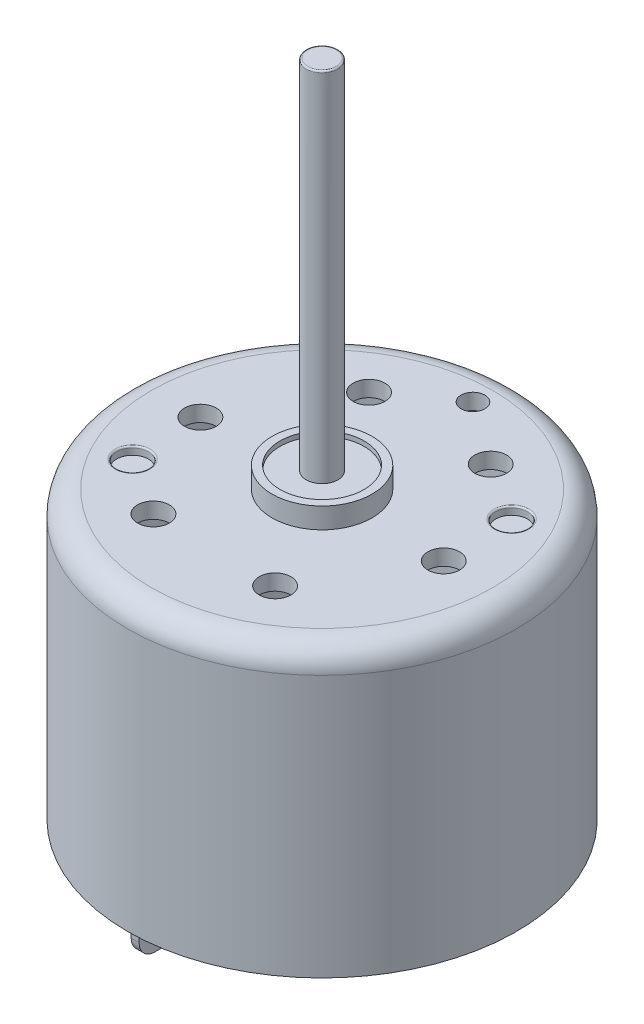
from build123d import *

# Parameters (mm, degrees)
SKETCH1_R               = 12.25
BOSS_EXTRUDE1_DEPTH     = 18
SKETCH2_R               = 3.15
BOSS_EXTRUDE2_DEPTH     = 1.3
SKETCH3_R               = 2.65
CUT_EXTRUDE1_DEPTH      = 0.3
SKETCH4_R               = 1
BOSS_EXTRUDE3_DEPTH     = 22.5
SKETCH5_R               = 11.75
CUT_EXTRUDE2_DEPTH      = 0.5
SKETCH6_R               = 3.25
BOSS_EXTRUDE4_DEPTH     = 2.2
SKETCH7_R               = 1.25
BOSS_EXTRUDE5_DEPTH     = 0.5
CUT_EXTRUDE3_START      = -0.25
SKETCH8_R               = 1.25
CUT_EXTRUDE3_DEPTH      = 0.25
SKETCH9_R               = 0.75
CUT_EXTRUDE4_DEPTH      = 5
SKETCH10_R              = 11.25
CUT_EXTRUDE5_DEPTH      = 16
SKETCH11_W              = 0.5
SKETCH11_H              = 2.5
BOSS_EXTRUDE6_DEPTH     = 3
CUT_EXTRUDE6_DEPTH      = 5
CUT_EXTRUDE6_DEPTH_BACK = 3
SKETCH12_R              = 0.5
FILLET1_R               = 1.5
FILLET2_R               = 1
SKETCH13_R              = 1
SKETCH13_R_2            = 0.75
CUT_EXTRUDE7_DEPTH      = 3
SKETCH14_R              = 1
CUT_EXTRUDE8_DEPTH      = 0.5
FILLET4_R               = 0.1
FILLET5_R               = 0.1


with BuildPart() as part:
    # Sketch1 → Boss-Extrude1 (new body)
    with BuildSketch(Plane(origin=(0, 0, 0), x_dir=(1, 0, 0), z_dir=(0, 1, 0))):
        with Locations(Location((0, 0, 0), (0, 0, 270))):
            Circle(SKETCH1_R)
    extrude(amount=BOSS_EXTRUDE1_DEPTH)

    # Sketch2 → Boss-Extrude2 (add)
    with BuildSketch(Plane(origin=(0, 18, 0), x_dir=(1, 0, 0), z_dir=(0, 1, 0))):
        with Locations(Location((0, 0, 0), (0, 0, 270))):
            Circle(SKETCH2_R)
    extrude(amount=BOSS_EXTRUDE2_DEPTH)

    # Sketch3 → Cut-Extrude1 (cut)
    with BuildSketch(Plane(origin=(0, 19.3, 0), x_dir=(1, 0, 0), z_dir=(0, 1, 0))):
        with Locations(Location((0, 0, 0), (0, 0, 270))):
            Circle(SKETCH3_R)
    extrude(amount=-CUT_EXTRUDE1_DEPTH, mode=Mode.SUBTRACT)

    # Sketch4 → Boss-Extrude3 (add)
    with BuildSketch(Plane(origin=(0, 19, 0), x_dir=(1, 0, 0), z_dir=(0, 1, 0))):
        with Locations(Location((0, 0, 0), (0, 0, 90))):
            Circle(SKETCH4_R)
    extrude(amount=BOSS_EXTRUDE3_DEPTH)

    # Sketch5 → Cut-Extrude2 (cut)
    with BuildSketch(Plane.XZ):
        with Locations(Location((0, 0, 0), (0, 0, 270))):
            Circle(SKETCH5_R)
    extrude(amount=-CUT_EXTRUDE2_DEPTH, mode=Mode.SUBTRACT)

    # Sketch6 → Boss-Extrude4 (add)
    with BuildSketch(Plane.XZ.offset(-0.5)):
        with Locations(Location((0, 0, 0), (0, 0, 270))):
            Circle(SKETCH6_R)
    extrude(amount=BOSS_EXTRUDE4_DEPTH)

    # Sketch7 → Boss-Extrude5 (add)
    with BuildSketch(Plane.XZ.offset(-0.5)):
        with Locations(Location((-5.125831592, -8.586375865, 0), (0, 0, 270))):
            Circle(SKETCH7_R)
        with Locations(Location((5.088620413, -8.586375865, 0), (0, 0, 90))):
            Circle(SKETCH7_R)
        with Locations(Location((5.088620413, 8.586375865, 0), (0, 0, 270))):
            Circle(SKETCH7_R)
        with Locations(Location((-5.125831592, 8.586375865, 0), (0, 0, 90))):
            Circle(SKETCH7_R)
        with BuildLine():
            Line((-2.01860559, -10.748327037), (1.98139441, -10.748327037))
            ThreePointArc((1.98139441, -10.748327037), (2.688501191, -10.455433818), (2.98139441, -9.748327037))
            Line((2.98139441, -9.748327037), (2.98139441, -8.748327037))
            ThreePointArc((2.98139441, -8.748327037), (2.688501191, -8.041220256), (1.98139441, -7.748327037))
            Line((1.98139441, -7.748327037), (-2.01860559, -7.748327037))
            ThreePointArc((-2.01860559, -7.748327037), (-2.725712371, -8.041220256), (-3.01860559, -8.748327037))
            Line((-3.01860559, -8.748327037), (-3.01860559, -9.748327037))
            ThreePointArc((-3.01860559, -9.748327037), (-2.725712371, -10.455433818), (-2.01860559, -10.748327037))
        make_face()
        with BuildLine():
            Line((2.98139441, 9.748327037), (2.98139441, 8.748327037))
            ThreePointArc((2.98139441, 8.748327037), (2.688501191, 8.041220256), (1.98139441, 7.748327037))
            Line((1.98139441, 7.748327037), (-2.01860559, 7.748327037))
            ThreePointArc((-2.01860559, 7.748327037), (-2.725712371, 8.041220256), (-3.01860559, 8.748327037))
            Line((-3.01860559, 8.748327037), (-3.01860559, 9.748327037))
            ThreePointArc((-3.01860559, 9.748327037), (-2.725712371, 10.455433818), (-2.01860559, 10.748327037))
            Line((-2.01860559, 10.748327037), (1.98139441, 10.748327037))
            ThreePointArc((1.98139441, 10.748327037), (2.688501191, 10.455433818), (2.98139441, 9.748327037))
        make_face()
    extrude(amount=BOSS_EXTRUDE5_DEPTH)

    # Sketch8 → Cut-Extrude3 (cut)
    with BuildSketch(Plane.XZ.offset(CUT_EXTRUDE3_START)):
        with Locations(Location((-5.125831592, -8.586375865, 0), (0, 0, 270))):
            Circle(SKETCH8_R)
        with Locations(Location((5.088620413, -8.586375865, 0), (0, 0, 90))):
            Circle(SKETCH8_R)
        with Locations(Location((5.088620413, 8.586375865, 0), (0, 0, 270))):
            Circle(SKETCH8_R)
        with Locations(Location((-5.125831592, 8.586375865, 0), (0, 0, 90))):
            Circle(SKETCH8_R)
    extrude(amount=CUT_EXTRUDE3_DEPTH, mode=Mode.SUBTRACT)

    # Sketch9 → Cut-Extrude4 (cut)
    with BuildSketch(Plane.XZ.offset(-0.5)):
        with Locations(Location((-5.716262807, -3.094242964, 0), (0, 0, 270))):
            Circle(SKETCH9_R)
        with Locations(Location((5.68290106, 3.155096757, 0), (0, 0, 270))):
            Circle(SKETCH9_R)
        with BuildLine():
            Line((-2.62995564, 2.940379794), (-3.030401514, 3.388091892))
            ThreePointArc((-3.030401514, 3.388091892), (-3.080727579, 3.536940742), (-3.007982197, 3.676213147))
            ThreePointArc((-3.007982197, 3.676213147), (-0.752566129, 4.690004714), (1.706803282, 4.432755639))
            ThreePointArc((1.706803282, 4.432755639), (1.819470443, 4.323234847), (1.818240908, 4.166113297))
            Line((1.818240908, 4.166113297), (1.577973384, 3.615591238))
            ThreePointArc((1.577973384, 3.615591238), (1.472408215, 3.51131746), (1.324054135, 3.508472694))
            ThreePointArc((1.324054135, 3.508472694), (-0.594131154, 3.702635301), (-2.355270039, 2.918082083))
            ThreePointArc((-2.355270039, 2.918082083), (-2.497066292, 2.874368833), (-2.62995564, 2.940379794))
        make_face()
        with BuildLine():
            Line((2.62995564, -2.940379794), (3.030401514, -3.388091892))
            ThreePointArc((3.030401514, -3.388091892), (3.080727579, -3.536940742), (3.007982197, -3.676213147))
            ThreePointArc((3.007982197, -3.676213147), (0.752566129, -4.690004714), (-1.706803282, -4.432755639))
            ThreePointArc((-1.706803282, -4.432755639), (-1.819470443, -4.323234847), (-1.818240908, -4.166113297))
            Line((-1.818240908, -4.166113297), (-1.577973384, -3.615591238))
            ThreePointArc((-1.577973384, -3.615591238), (-1.472408215, -3.51131746), (-1.324054135, -3.508472694))
            ThreePointArc((-1.324054135, -3.508472694), (0.594131154, -3.702635301), (2.355270039, -2.918082083))
            ThreePointArc((2.355270039, -2.918082083), (2.497066292, -2.874368833), (2.62995564, -2.940379794))
        make_face()
    extrude(amount=-CUT_EXTRUDE4_DEPTH, mode=Mode.SUBTRACT)

    # Sketch10 → Cut-Extrude5 (cut)
    with BuildSketch(Plane(origin=(0, 17, 0), x_dir=(1, 0, 0), z_dir=(0, 1, 0))):
        with Locations(Location((0, 0, 0), (0, 0, 270))):
            Circle(SKETCH10_R)
    extrude(amount=-CUT_EXTRUDE5_DEPTH, mode=Mode.SUBTRACT)

    # Sketch11 → Boss-Extrude6 (add)
    with BuildSketch(Plane.XZ):
        with Locations((1.23139441, -9.248327037)):
            Rectangle(SKETCH11_W, SKETCH11_H)
        with Locations((-1.26860559, 9.248327037)):
            Rectangle(SKETCH11_W, SKETCH11_H)
    extrude(amount=BOSS_EXTRUDE6_DEPTH)

    # Sketch12 → Cut-Extrude6 (cut, two sides: drawn at the far end of the back side and taken through both)
    with BuildSketch(Plane.ZY.offset(-0.98139441).offset(-CUT_EXTRUDE6_DEPTH_BACK)):
        with BuildLine():
            Line((-10.498327037, -3), (-9.498327037, -3))
            ThreePointArc((-9.498327037, -3), (-10.205433818, -2.707106781), (-10.498327037, -2))
            Line((-10.498327037, -2), (-10.498327037, -3))
        make_face()
        with BuildLine():
            ThreePointArc((-7.998327037, -2), (-8.291220256, -2.707106781), (-8.998327037, -3))
            Line((-8.998327037, -3), (-7.998327037, -3))
            Line((-7.998327037, -3), (-7.998327037, -2))
        make_face()
        with Locations(Location((-9.248327037, -2, 0), (0, 0, 180))):
            Circle(SKETCH12_R)
        with BuildLine():
            Line((7.998327037, -3), (8.998327037, -3))
            ThreePointArc((8.998327037, -3), (8.291220256, -2.707106781), (7.998327037, -2))
            Line((7.998327037, -2), (7.998327037, -3))
        make_face()
        with BuildLine():
            ThreePointArc((10.498327037, -2), (10.205433818, -2.707106781), (9.498327037, -3))
            Line((9.498327037, -3), (10.498327037, -3))
            Line((10.498327037, -3), (10.498327037, -2))
        make_face()
        with Locations(Location((9.248327037, -2, 0), (0, 0, 180))):
            Circle(SKETCH12_R)
    extrude(amount=CUT_EXTRUDE6_DEPTH + CUT_EXTRUDE6_DEPTH_BACK, mode=Mode.SUBTRACT)

    # Fillet1
    fillet1_edges = [part.edges().sort_by_distance(p)[0] for p in [
        (0, 18, -12.25),
    ]]
    fillet(fillet1_edges, radius=FILLET1_R)

    # Fillet2
    fillet2_edges = [part.edges().sort_by_distance(p)[0] for p in [
        (0, -1.7, 3.25),
    ]]
    fillet(fillet2_edges, radius=FILLET2_R)

    # Sketch13 → Cut-Extrude7 (cut)
    with BuildSketch(Plane(origin=(0, 18, 0), x_dir=(1, 0, 0), z_dir=(0, 1, 0))):
        with Locations(Location((3.951197057, 6.667123954, 0), (0, 0, 270))):
            Circle(SKETCH13_R)
        with Locations(Location((7.749497243, -0.08827505, 0), (0, 0, 270))):
            Circle(SKETCH13_R)
        with Locations(Location((3.798300186, -6.755399004, 0), (0, 0, 270))):
            Circle(SKETCH13_R)
        with Locations(Location((-3.951197057, -6.667123954, 0), (0, 0, 270))):
            Circle(SKETCH13_R)
        with Locations(Location((-7.749497243, 0.08827505, 0), (0, 0, 270))):
            Circle(SKETCH13_R)
        with Locations(Location((-3.798300186, 6.755399004, 0), (0, 0, 270))):
            Circle(SKETCH13_R)
        with Locations(Location((0, 9.5, 0), (0, 0, 270))):
            Circle(SKETCH13_R_2)
    extrude(amount=-CUT_EXTRUDE7_DEPTH, mode=Mode.SUBTRACT)

    # Sketch14 → Cut-Extrude8 (cut)
    with BuildSketch(Plane(origin=(0, 18, 0), x_dir=(1, 0, 0), z_dir=(0, 1, 0))):
        with Locations(Location((7.602516136, 4.331771971, 0), (0, 0, 270))):
            Circle(SKETCH14_R)
        with Locations(Location((-7.602516136, -4.331771971, 0), (0, 0, 270))):
            Circle(SKETCH14_R)
    extrude(amount=-CUT_EXTRUDE8_DEPTH, mode=Mode.SUBTRACT)

    # Fillet4
    fillet4_edges = [part.edges().sort_by_distance(p)[0] for p in [
        (7.602516136, 18, -5.331771971),
        (-7.602516136, 18, 3.331771971),
    ]]
    fillet(fillet4_edges, radius=FILLET4_R)

    # Fillet5
    fillet5_edges = [part.edges().sort_by_distance(p)[0] for p in [
        (0, 41.5, 1),
    ]]
    fillet(fillet5_edges, radius=FILLET5_R)


solid = part.part
